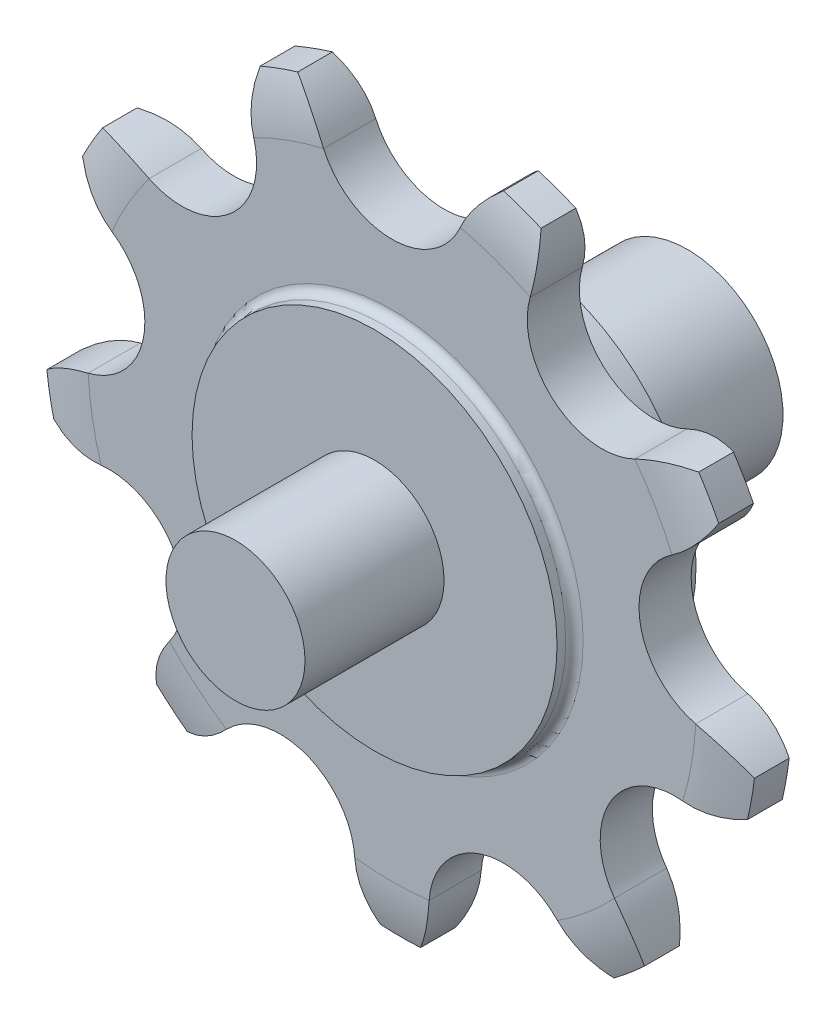
from build123d import *

# Parameters (mm, degrees)
BOSS_EXTRUDE1_DEPTH = 1.5
SKETCH3_R           = 10.5
BOSS_EXTRUDE2_DEPTH = 1
FILLET1_R           = 0.5
BOSS_EXTRUDE3_START = 4
SKETCH4_R           = 10.5
BOSS_EXTRUDE3_DEPTH = 4
FILLET2_R           = 0.5
SKETCH6_R           = 4
BOSS_EXTRUDE4_DEPTH = 8
SKETCH7_R           = 5.5
BOSS_EXTRUDE5_DEPTH = 10


with BuildPart() as part:
    # Sketch1 → Boss-Extrude1 (new, symmetric)
    with BuildSketch(Plane.XY):
        with BuildLine():
            ThreePointArc((8.079170849, 18.840833272), (7.548253676, 19.059744658), (7.011412938, 19.263698726))
            ThreePointArc((7.011412938, 19.263698726), (6.469069926, 19.452535421), (5.92165025, 19.62610655))
            ThreePointArc((5.92165025, 19.62610655), (4.769916061, 18.460076292), (3.92920603, 17.053191489))
            ThreePointArc((3.92920603, 17.053191489), (0, 14.5), (-3.92920603, 17.053191489))
            ThreePointArc((-3.92920603, 17.053191489), (-4.769916061, 18.460076292), (-5.92165025, 19.62610655))
            ThreePointArc((-5.92165025, 19.62610655), (-6.469069926, 19.452535421), (-7.011412938, 19.263698726))
            ThreePointArc((-7.011412938, 19.263698726), (-7.548253676, 19.059744658), (-8.079170849, 18.840833272))
            ThreePointArc((-8.079170849, 18.840833272), (-8.211940621, 17.207281806), (-7.95163375, 15.58914753))
            ThreePointArc((-7.95163375, 15.58914753), (-9.32042034, 11.107644425), (-13.97152664, 10.537857626))
            ThreePointArc((-13.97152664, 10.537857626), (-15.519876007, 11.07519592), (-17.151665385, 11.228106453))
            ThreePointArc((-17.151665385, 11.228106453), (-17.459443815, 10.743268669), (-17.753520778, 10.25))
            ThreePointArc((-17.753520778, 10.25), (-18.033665494, 9.748687545), (-18.299658117, 9.239724714))
            ThreePointArc((-18.299658117, 9.239724714), (-17.351339022, 7.903008926), (-16.111815726, 6.830768187))
            ThreePointArc((-16.111815726, 6.830768187), (-14.279712419, 2.517898576), (-17.476414659, -0.908256936))
            ThreePointArc((-17.476414659, -0.908256936), (-19.007913485, -1.491891711), (-20.356225667, -2.423649439))
            ThreePointArc((-20.356225667, -2.423649439), (-20.280349902, -2.992892892), (-20.188558937, -3.559787642))
            ThreePointArc((-20.188558937, -3.559787642), (-20.080924805, -4.123888815), (-19.957531975, -4.684753727))
            ThreePointArc((-19.957531975, -4.684753727), (-18.371853055, -5.099169663), (-16.73310006, -5.123803506))
            ThreePointArc((-16.73310006, -5.123803506), (-12.557368355, -7.25), (-12.80389403, -11.929387983))
            ThreePointArc((-12.80389403, -11.929387983), (-13.601936994, -13.360906629), (-14.035881725, -14.941352824))
            ThreePointArc((-14.035881725, -14.941352824), (-13.611854879, -15.328646605), (-13.177145999, -15.703911084))
            ThreePointArc((-13.177145999, -15.703911084), (-12.732096226, -16.066851767), (-12.277054818, -16.417183833))
            ThreePointArc((-12.277054818, -16.417183833), (-10.795972864, -15.715390096), (-9.524780909, -14.680890594))
            ThreePointArc((-9.524780909, -14.680890594), (-4.959292078, -13.625543001), (-2.140289085, -17.368625813))
            ThreePointArc((-2.140289085, -17.368625813), (-1.831463015, -18.978204846), (-1.147992733, -20.467831167))
            ThreePointArc((-1.147992733, -20.467831167), (-0.574221679, -20.491956214), (0, -20.5))
            ThreePointArc((0, -20.5), (0.574221679, -20.491956214), (1.147992733, -20.467831167))
            ThreePointArc((1.147992733, -20.467831167), (1.831463015, -18.978204846), (2.140289085, -17.368625813))
            ThreePointArc((2.140289085, -17.368625813), (4.959292078, -13.625543001), (9.524780909, -14.680890594))
            ThreePointArc((9.524780909, -14.680890594), (10.795972864, -15.715390096), (12.277054818, -16.417183833))
            ThreePointArc((12.277054818, -16.417183833), (12.732096226, -16.066851767), (13.177145999, -15.703911084))
            ThreePointArc((13.177145999, -15.703911084), (13.611854879, -15.328646605), (14.035881725, -14.941352824))
            ThreePointArc((14.035881725, -14.941352824), (13.601936994, -13.360906629), (12.80389403, -11.929387983))
            ThreePointArc((12.80389403, -11.929387983), (12.557368355, -7.25), (16.73310006, -5.123803506))
            ThreePointArc((16.73310006, -5.123803506), (18.371853055, -5.099169663), (19.957531975, -4.684753727))
            ThreePointArc((19.957531975, -4.684753727), (20.080924805, -4.123888815), (20.188558937, -3.559787642))
            ThreePointArc((20.188558937, -3.559787642), (20.280349902, -2.992892892), (20.356225667, -2.423649439))
            ThreePointArc((20.356225667, -2.423649439), (19.007913485, -1.491891711), (17.476414659, -0.908256936))
            ThreePointArc((17.476414659, -0.908256936), (14.279712419, 2.517898576), (16.111815726, 6.830768187))
            ThreePointArc((16.111815726, 6.830768187), (17.351339022, 7.903008926), (18.299658117, 9.239724714))
            ThreePointArc((18.299658117, 9.239724714), (18.033665494, 9.748687545), (17.753520778, 10.25))
            ThreePointArc((17.753520778, 10.25), (17.459443815, 10.743268669), (17.151665385, 11.228106453))
            ThreePointArc((17.151665385, 11.228106453), (15.519876007, 11.07519592), (13.97152664, 10.537857626))
            ThreePointArc((13.97152664, 10.537857626), (9.32042034, 11.107644425), (7.95163375, 15.58914753))
            ThreePointArc((7.95163375, 15.58914753), (8.211940621, 17.207281806), (8.079170849, 18.840833272))
        make_face()
    extrude(amount=BOSS_EXTRUDE1_DEPTH, both=True)

    # Sketch2 → Cut-Revolve2 (revolve, cut)
    with BuildSketch(Plane(origin=(0, 0, 0), x_dir=(0, 0, -1), z_dir=(1, 0, 0))):
        with BuildLine():
            Line((-1.5, -17.5), (-1.5, -20.5))
            Line((-1.5, -20.5), (-1, -20.5))
            ThreePointArc((-1, -20.5), (-1.374143795, -19.020690633), (-1.5, -17.5))
        make_face()
    cut_revolve2 = revolve(axis=Axis((0, 0, 0), (0, 0, 1)), mode=Mode.SUBTRACT)

    # Mirror1: Cut-Revolve2 across plane
    add(cut_revolve2.mirror(Plane.XY), mode=Mode.SUBTRACT)

    # Sketch3 → Boss-Extrude2 (add)
    with BuildSketch(Plane.XY.offset(1.5)):
        Circle(SKETCH3_R)
    extrude(amount=BOSS_EXTRUDE2_DEPTH)

    # Fillet1
    fillet1_edges = [part.edges().sort_by_distance(p)[0] for p in [
        (-10.5, 0, 1.5),
    ]]
    fillet(fillet1_edges, radius=FILLET1_R)

    # Sketch4 → Boss-Extrude3 (add)
    with BuildSketch(Plane(origin=(0, 0, -1.5), x_dir=(-1, 0, 0), z_dir=(0, 0, -1)).offset(BOSS_EXTRUDE3_START)):
        with Locations(Location((0, 0, 0), (0, 0, 180))):
            Circle(SKETCH4_R)
    extrude(amount=-BOSS_EXTRUDE3_DEPTH)

    # Fillet2
    fillet2_edges = [part.edges().sort_by_distance(p)[0] for p in [
        (-10.5, 0, -1.5),
    ]]
    fillet(fillet2_edges, radius=FILLET2_R)

    # Sketch6 → Boss-Extrude4 (add)
    with BuildSketch(Plane.XY.offset(2.5)):
        Circle(SKETCH6_R)
    extrude(amount=BOSS_EXTRUDE4_DEPTH)

    # Sketch7 → Boss-Extrude5 (add)
    with BuildSketch(Plane(origin=(0, 0, -5.5), x_dir=(-1, 0, 0), z_dir=(0, 0, -1))):
        Circle(SKETCH7_R)
    extrude(amount=BOSS_EXTRUDE5_DEPTH)


solid = part.part
